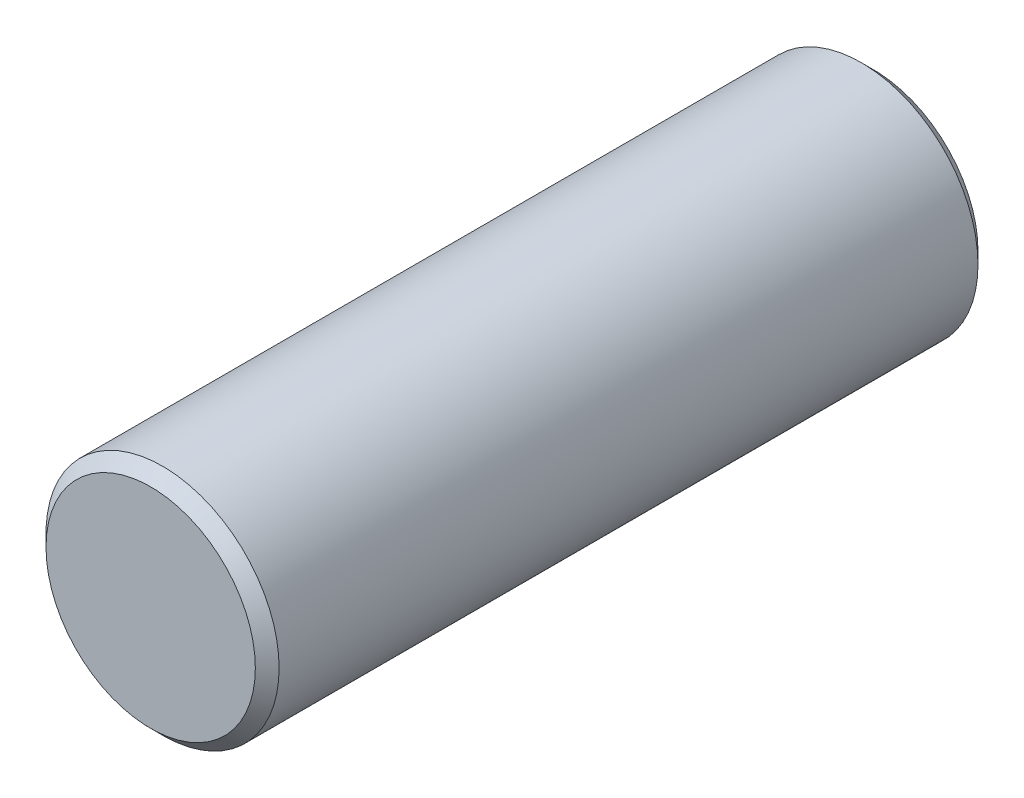
from build123d import *

# Parameters (mm, degrees)
SKETCH1_R           = 5
BOSS_EXTRUDE1_DEPTH = 15.5
CHAMFER1_SIZE       = 0.51


with BuildPart() as part:
    # Sketch1 → Boss-Extrude1 (new, symmetric)
    with BuildSketch(Plane.XY):
        Circle(SKETCH1_R)
    extrude(amount=BOSS_EXTRUDE1_DEPTH, both=True)

    # Chamfer1
    chamfer1_edges = [part.edges().sort_by_distance(p)[0] for p in [
        (-5, 0, -15.5),
        (-5, 0, 15.5),
    ]]
    chamfer(chamfer1_edges, length=CHAMFER1_SIZE)


solid = part.part
